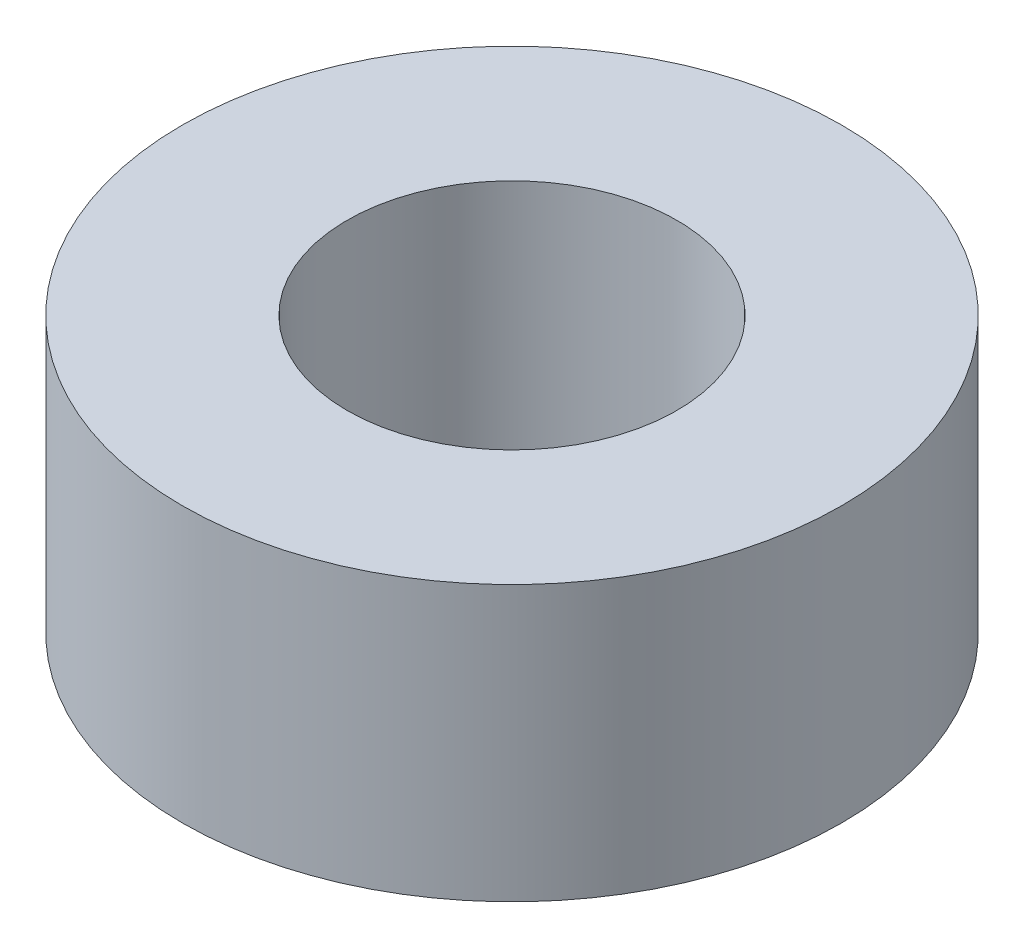
from build123d import *

# Parameters (mm, degrees)
SKETCH1_R           = 3
SKETCH1_R_2         = 1.5
BOSS_EXTRUDE1_DEPTH = 2.5


with BuildPart() as part:
    # Sketch1 → Boss-Extrude1 (new body)
    with BuildSketch(Plane(origin=(0, 0, 0), x_dir=(1, 0, 0), z_dir=(0, 1, 0))):
        with Locations(Location((0, 0, 0), (0, 0, 270))):
            Circle(SKETCH1_R)
        with Locations(Location((0, 0, 0), (0, 0, 270))):
            Circle(SKETCH1_R_2, mode=Mode.SUBTRACT)
    extrude(amount=BOSS_EXTRUDE1_DEPTH)


solid = part.part
